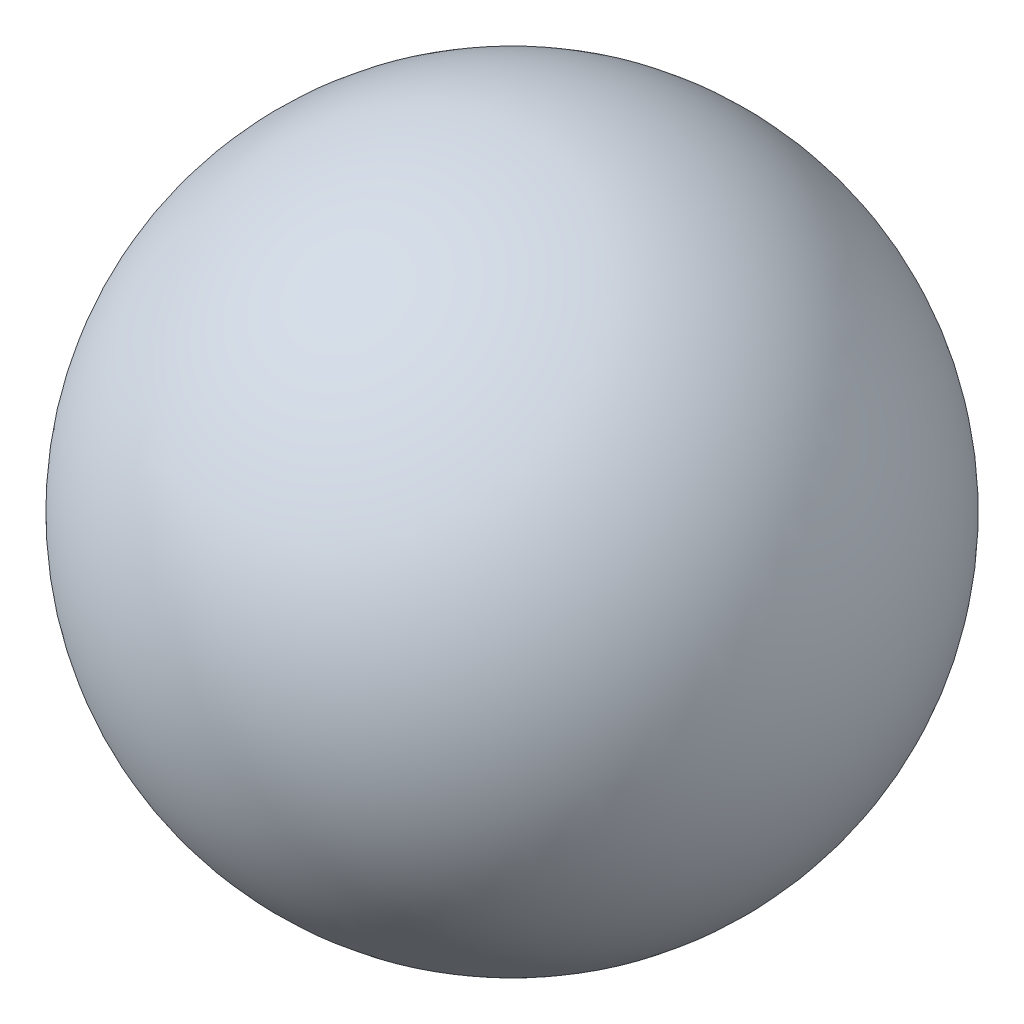
from build123d import *


with BuildPart() as part:
    # Sketch2 → Revolve2 (revolve)
    with BuildSketch(Plane.XY):
        with BuildLine():
            Line((0, 2.921), (0, -2.921))
            ThreePointArc((0, -2.921), (2.921, 0), (0, 2.921))
        make_face()
    revolve(axis=Axis((0, 2.921, 0), (0, -1, 0)))


solid = part.part
